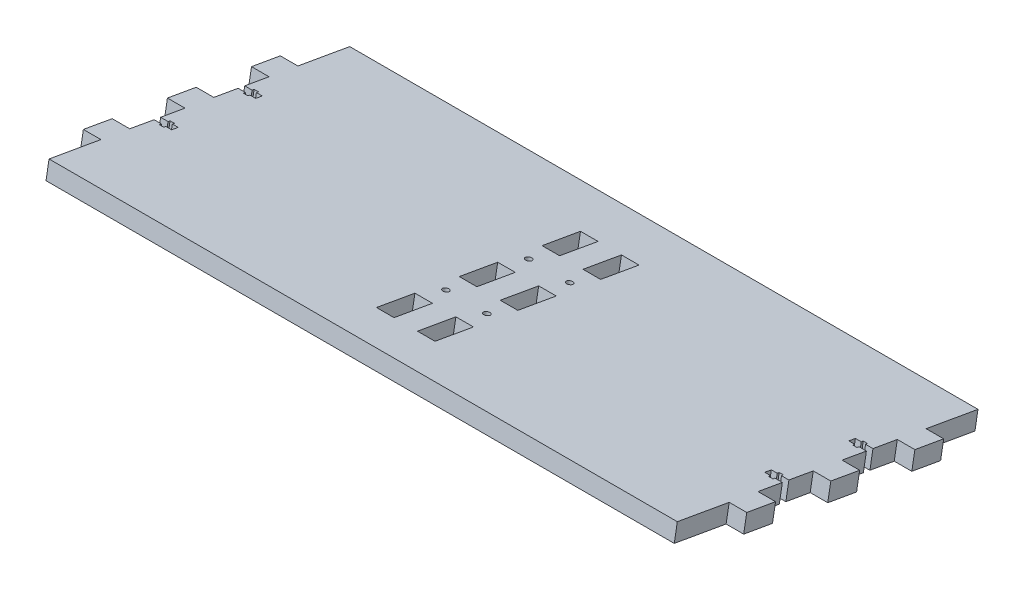
from build123d import *

# Parameters (mm, degrees)
BOSS_EXTRUDE1_DEPTH = 9
CUT_EXTRUDE1_DEPTH  = 265.443626141
SKETCH5_R           = 1.6
SKETCH5_W           = 9
SKETCH5_H           = 20
CUT_EXTRUDE2_DEPTH  = 265.443626141


with BuildPart() as part:
    # Sketch2 → Boss-Extrude1 (new body)
    with BuildSketch(Plane(origin=(0, -59.966770125, 10.573759519), x_dir=(1, 0, 0), z_dir=(0, 0.9848077530122079, -0.1736481776669316))):
        Polygon((-80, -33.247729948), (-89, -33.247729948), (-89, -48.247729948), (-80, -48.247729948), (-80, -75.240683317), (242, -75.240683317), (242, -48.247729948), (251, -48.247729948), (251, -33.247729948), (242, -33.247729948), (242, -4.497729948), (251, -4.497729948), (251, 10.502270052), (242, 10.502270052), (242, 39.252270052), (251, 39.252270052), (251, 54.252270052), (242, 54.252270052), (242, 81.245223421), (-80, 81.245223421), (-80, 54.252270052), (-89, 54.252270052), (-89, 39.252270052), (-80, 39.252270052), (-80, 10.502270052), (-89, 10.502270052), (-89, -4.497729948), (-80, -4.497729948), align=None)
    extrude(amount=BOSS_EXTRUDE1_DEPTH)

    # Sketch4 → Cut-Extrude1 (cut, through all)
    with BuildSketch(Plane(origin=(0, -51.103500347, 9.01092592), x_dir=(1, 0, 0), z_dir=(0, 0.9848077530122079, -0.17364817766693172))):
        Polygon((-80, -17.172729948), (-76.2, -17.172729948), (-76.2, -16.122729948), (-74, -16.122729948), (-74, -17.172729948), (-71, -17.172729948), (-71, -20.572729948), (-74, -20.572729948), (-74, -21.622729948), (-76.2, -21.622729948), (-76.2, -20.572729948), (-80, -20.572729948), align=None)
        Polygon((-80, 23.177270052), (-80, 26.577270052), (-76.2, 26.577270052), (-76.2, 27.627270052), (-74, 27.627270052), (-74, 26.577270052), (-71, 26.577270052), (-71, 23.177270052), (-74, 23.177270052), (-74, 22.127270052), (-76.2, 22.127270052), (-76.2, 23.177270052), align=None)
        Polygon((242, 23.177270052), (238.2, 23.177270052), (238.2, 22.127270052), (236, 22.127270052), (236, 23.177270052), (233, 23.177270052), (233, 26.577270052), (236, 26.577270052), (236, 27.627270052), (238.2, 27.627270052), (238.2, 26.577270052), (242, 26.577270052), align=None)
        Polygon((242, -17.172729948), (242, -20.572729948), (238.2, -20.572729948), (238.2, -21.622729948), (236, -21.622729948), (236, -20.572729948), (233, -20.572729948), (233, -17.172729948), (236, -17.172729948), (236, -16.122729948), (238.2, -16.122729948), (238.2, -17.172729948), align=None)
    extrude(amount=-CUT_EXTRUDE1_DEPTH, mode=Mode.SUBTRACT)

    # Sketch5 → Cut-Extrude2 (cut, through all)
    with BuildSketch(Plane(origin=(0, -51.103500347, 9.01092592), x_dir=(1, 0, 0), z_dir=(0, 0.9848077530122078, -0.1736481776669317))):
        with Locations(Location((91.5, -21.542669597, 0), (0, 0, 270))):
            Circle(SKETCH5_R)
        with Locations(Location((91.5, 21.542669597, 0), (0, 0, 270))):
            Circle(SKETCH5_R)
        with Locations((91.5, -43.085339194)):
            Rectangle(SKETCH5_W, SKETCH5_H)
        with Locations((91.5, 0)):
            Rectangle(SKETCH5_W, SKETCH5_H)
        with Locations((91.5, 43.085339194)):
            Rectangle(SKETCH5_W, SKETCH5_H)
    cut_extrude2 = extrude(amount=-CUT_EXTRUDE2_DEPTH, mode=Mode.SUBTRACT)

    # Mirror1: Cut-Extrude2 across plane
    add(cut_extrude2.mirror(Plane.ZY.offset(-81)), mode=Mode.SUBTRACT)


solid = part.part
